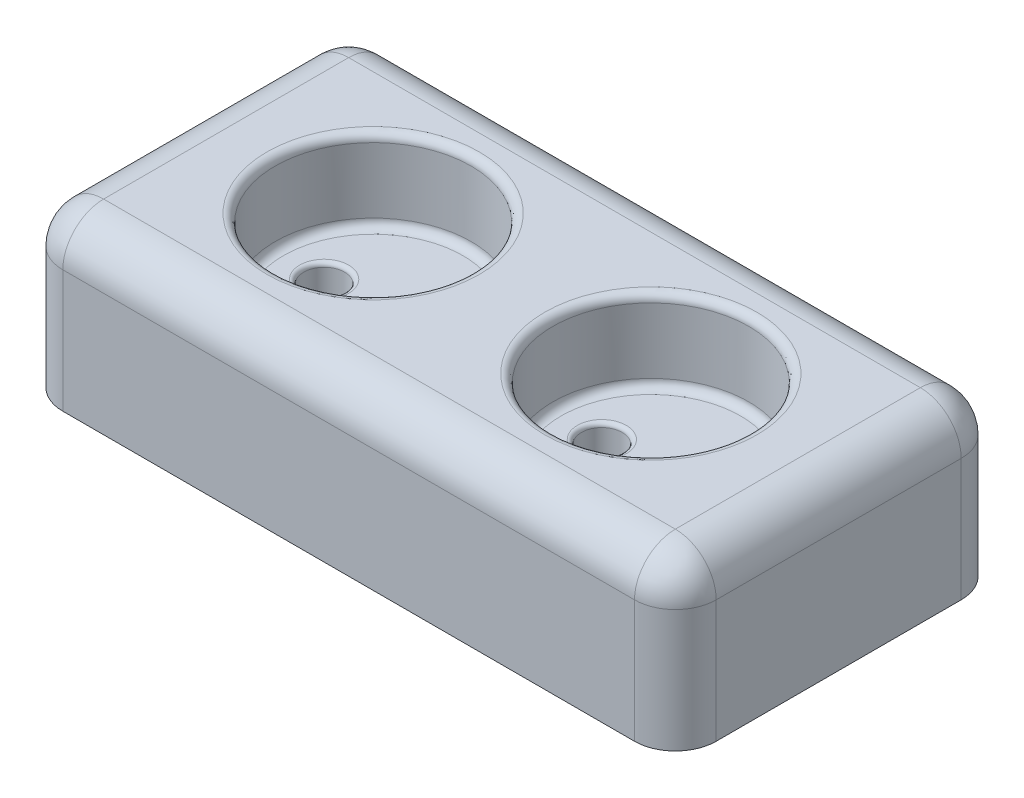
from build123d import *

# Parameters (mm, degrees)
SKETCH_1_W          = 80
SKETCH_1_H          = 40
EXTRUDE_1_DEPTH     = 20
SKETCH_3_R          = 12
CUT_EXTRUDE_1_DEPTH = 10
SKETCH_5_R          = 2.5
CUT_EXTRUDE_2_DEPTH = 59.920436956
FILLET_1_R          = 5
FILLET_2_R          = 5
FILLET_3_R          = 1
FILLET_4_R          = 0.5


with BuildPart() as part:
    # 스케치1 → 보스-돌출1 (new body)
    with BuildSketch(Plane(origin=(0, 0, 0), x_dir=(1, 0, 0), z_dir=(0, 1, 0))):
        with Locations((-10.199371704, -9.182888335)):
            Rectangle(SKETCH_1_W, SKETCH_1_H)
    extrude(amount=EXTRUDE_1_DEPTH)

    # 스케치3 → 컷-돌출1 (cut)
    with BuildSketch(Plane(origin=(0, 20, 0), x_dir=(1, 0, 0), z_dir=(0, 1, 0))):
        with Locations(Location((-27.199371704, -9.182888335, 0), (0, 0, 270))):
            Circle(SKETCH_3_R)
        with Locations(Location((6.800628296, -9.182888335, 0), (0, 0, 270))):
            Circle(SKETCH_3_R)
    extrude(amount=-CUT_EXTRUDE_1_DEPTH, mode=Mode.SUBTRACT)

    # 스케치5 → 컷-돌출2 (cut, through all)
    with BuildSketch(Plane(origin=(0, 10, 0), x_dir=(1, 0, 0), z_dir=(0, 1, 0))):
        with Locations(Location((-33.199371704, -9.182888335, 0), (0, 0, 270))):
            Circle(SKETCH_5_R)
        with Locations(Location((-21.199371704, -9.182888335, 0), (0, 0, 270))):
            Circle(SKETCH_5_R)
        with Locations(Location((0.800628296, -9.182888335, 0), (0, 0, 270))):
            Circle(SKETCH_5_R)
        with Locations(Location((12.800628296, -9.182888335, 0), (0, 0, 270))):
            Circle(SKETCH_5_R)
    extrude(amount=-CUT_EXTRUDE_2_DEPTH, mode=Mode.SUBTRACT)

    # 필렛1
    fillet_1_edges = [part.edges().sort_by_distance(p)[0] for p in [
        (-50.199371704, 10, -10.817111665),
        (29.800628296, 10, -10.817111665),
        (29.800628296, 10, 29.182888335),
        (-50.199371704, 10, 29.182888335),
    ]]
    fillet(fillet_1_edges, radius=FILLET_1_R)

    # 필렛2
    fillet_2_edges = [part.edges().sort_by_distance(p)[0] for p in [
        (-50.199371704, 20, 9.182888335),
        (-10.199371704, 20, -10.817111665),
        (-10.199371704, 20, 29.182888335),
        (29.800628296, 20, 9.182888335),
        (-48.73490561, 20, 27.718422241),
        (28.336162202, 20, 27.718422241),
        (28.336162202, 20, -9.352645571),
        (-48.73490561, 20, -9.352645571),
    ]]
    fillet(fillet_2_edges, radius=FILLET_2_R)

    # 필렛3
    fillet_3_edges = [part.edges().sort_by_distance(p)[0] for p in [
        (6.800628296, 10, -2.817111665),
        (6.800628296, 20, -2.817111665),
        (-27.199371704, 10, -2.817111665),
        (-27.199371704, 20, -2.817111665),
    ]]
    fillet(fillet_3_edges, radius=FILLET_3_R)

    # 필렛4
    fillet_4_edges = [part.edges().sort_by_distance(p)[0] for p in [
        (-33.199371704, 10, 6.682888335),
        (-21.199371704, 10, 6.682888335),
        (0.800628296, 10, 6.682888335),
        (12.800628296, 10, 6.682888335),
    ]]
    fillet(fillet_4_edges, radius=FILLET_4_R)


solid = part.part
